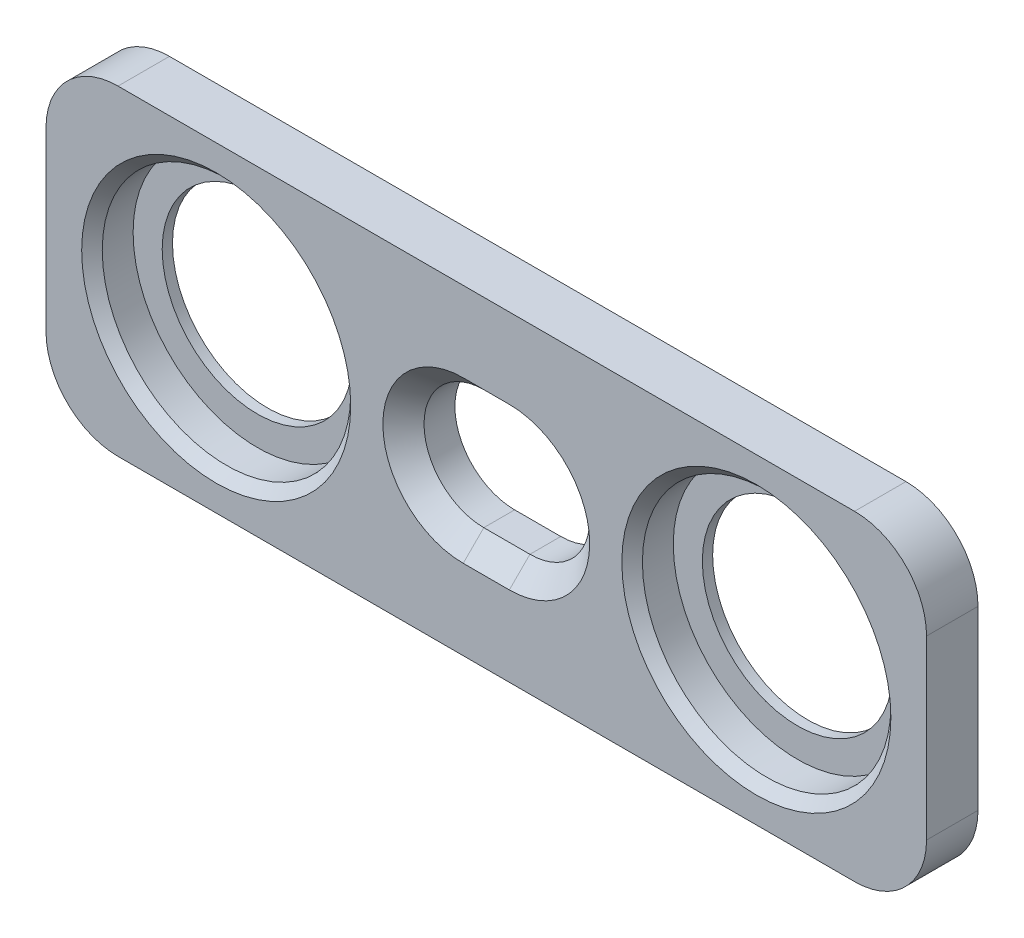
from build123d import *

# Parameters (mm, degrees)
CROQUIS1_W              = 85.583933156
CROQUIS1_H              = 31.172413686
CROQUIS1_R              = 12.075
SALIENTE_EXTRUIR1_DEPTH = 5
CROQUIS2_W              = 85.583933156
CROQUIS2_H              = 31.172413686
CROQUIS2_R              = 9.25
SALIENTE_EXTRUIR2_DEPTH = 1
REDONDEO1_R             = 7
CORTAR_EXTRUIR1_DEPTH   = 46.815742353
CHAFL_N1_SIZE           = 2
CHAFL_N2_SIZE           = 1


with BuildPart() as part:
    # Croquis1 → Saliente-Extruir1 (new body)
    with BuildSketch(Plane.XY):
        Rectangle(CROQUIS1_W, CROQUIS1_H)
        with Locations((-26.25, 0)):
            Circle(CROQUIS1_R, mode=Mode.SUBTRACT)
        with Locations((26.25, 0)):
            Circle(CROQUIS1_R, mode=Mode.SUBTRACT)
    extrude(amount=SALIENTE_EXTRUIR1_DEPTH)

    # Croquis2 → Saliente-Extruir2 (add)
    with BuildSketch(Plane(origin=(0, 0, 0), x_dir=(-1, 0, 0), z_dir=(0, 0, -1))):
        Rectangle(CROQUIS2_W, CROQUIS2_H)
        with Locations((-26.25, 0)):
            Circle(CROQUIS2_R, mode=Mode.SUBTRACT)
        with Locations((26.25, 0)):
            Circle(CROQUIS2_R, mode=Mode.SUBTRACT)
    extrude(amount=-SALIENTE_EXTRUIR2_DEPTH)

    # Redondeo1
    redondeo1_edges = [part.edges().sort_by_distance(p)[0] for p in [
        (42.791966578, -15.586206843, 2.5),
        (-42.791966578, -15.586206843, 2.5),
        (-42.791966578, 15.586206843, 2.5),
        (42.791966578, 15.586206843, 2.5),
    ]]
    fillet(redondeo1_edges, radius=REDONDEO1_R)

    # Croquis3 → Cortar-Extruir1 (cut, through all)
    with BuildSketch(Plane.XY.offset(5)):
        with BuildLine():
            Line((-2.24145708, 5.808706223), (2.24145708, 5.808706223))
            ThreePointArc((2.24145708, 5.808706223), (8.050163302, 0), (2.24145708, -5.808706223))
            Line((2.24145708, -5.808706223), (-2.24145708, -5.808706223))
            ThreePointArc((-2.24145708, -5.808706223), (-8.050163302, 0), (-2.24145708, 5.808706223))
        make_face()
    extrude(amount=-CORTAR_EXTRUIR1_DEPTH, mode=Mode.SUBTRACT)

    # Chaflán1
    chafl_n1_edges = [part.edges().sort_by_distance(p)[0] for p in [
        (-8.050163302, 0, 5),
        (0, -5.808706223, 5),
        (8.050163302, 0, 5),
        (0, 5.808706223, 5),
    ]]
    chamfer(chafl_n1_edges, length=CHAFL_N1_SIZE)

    # Chaflán2
    chafl_n2_edges = [part.edges().sort_by_distance(p)[0] for p in [
        (-38.325, 0, 5),
        (14.175, 0, 5),
    ]]
    chamfer(chafl_n2_edges, length=CHAFL_N2_SIZE)


solid = part.part
